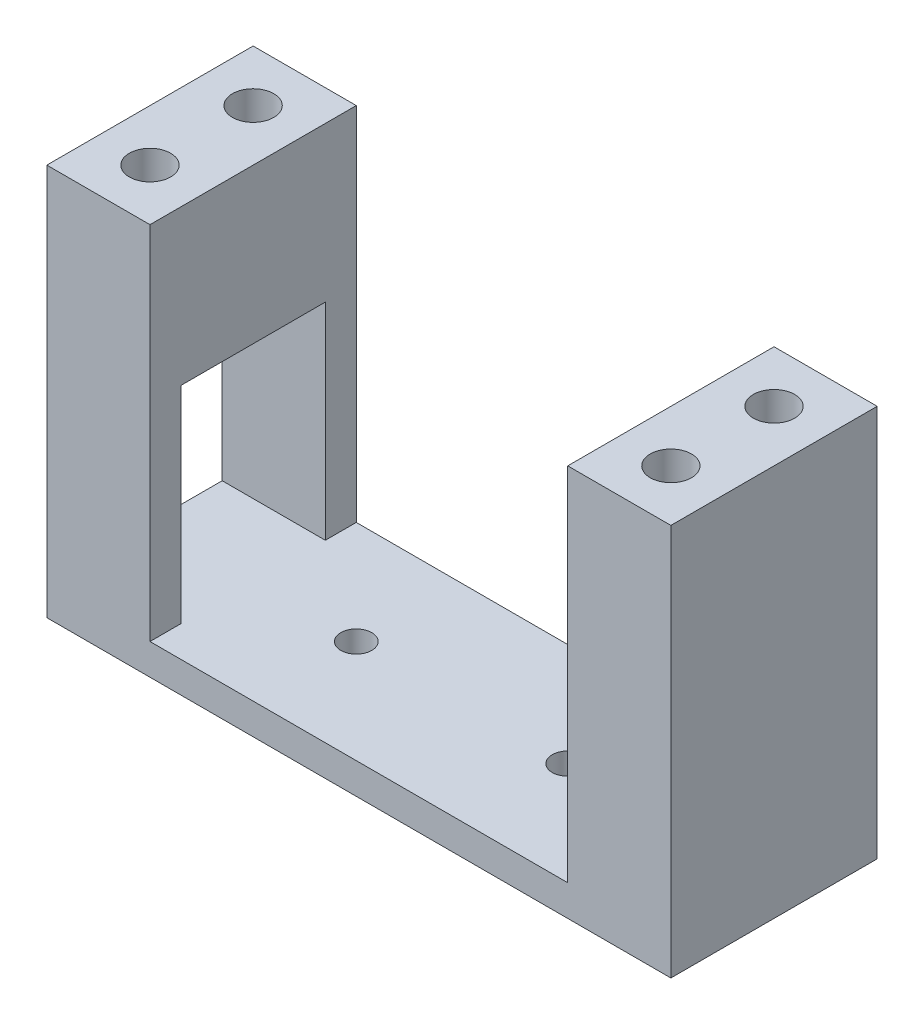
from build123d import *

# Parameters (mm, degrees)
EXTRUDE_2_DEPTH     = 20
CUT_EXTRUDE_1_REACH = 76.191
SKETCH_3_W          = 14
SKETCH_3_H          = 20
SKETCH_4_R          = 2
CUT_EXTRUDE_2_DEPTH = 10
SKETCH_5_R          = 1.5
CUT_EXTRUDE_3_DEPTH = 10


with BuildPart() as part:
    # Эскиз2 → Бобышка-Вытянуть2 (new body)
    with BuildSketch(Plane.XY):
        Polygon((0, 0), (60.5, 0), (60.5, 38), (50.5, 38), (50.5, 3), (10, 3), (10, 38), (0, 38), align=None)
    extrude(amount=EXTRUDE_2_DEPTH)

    # Эскиз3 → Вырез-Вытянуть1 (cut, up to next)
    with BuildSketch(Plane.ZY, mode=Mode.PRIVATE) as cut_extrude_1_sk1:
        with Locations((10, 13)):
            Rectangle(SKETCH_3_W, SKETCH_3_H)
    cut_extrude_1_tool1 = extrude(cut_extrude_1_sk1.sketch, amount=-CUT_EXTRUDE_1_REACH, mode=Mode.PRIVATE) & part.part
    add(cut_extrude_1_tool1.solids().sort_by_distance((0, 13, 10))[0], mode=Mode.SUBTRACT)

    # Эскиз4 → Вырез-Вытянуть2 (cut)
    with BuildSketch(Plane(origin=(0, 38, 0), x_dir=(1, 0, 0), z_dir=(0, 1, 0))):
        with Locations(Location((5, -5, 0), (0, 0, 270))):
            Circle(SKETCH_4_R)
        with Locations(Location((5, -15, 0), (0, 0, 270))):
            Circle(SKETCH_4_R)
        with Locations(Location((55.5, -5, 0), (0, 0, 270))):
            Circle(SKETCH_4_R)
        with Locations(Location((55.5, -15, 0), (0, 0, 270))):
            Circle(SKETCH_4_R)
    extrude(amount=-CUT_EXTRUDE_2_DEPTH, mode=Mode.SUBTRACT)

    # Эскиз5 → Вырез-Вытянуть3 (cut)
    with BuildSketch(Plane.XZ):
        with Locations(Location((20, 10, 0), (0, 0, 270))):
            Circle(SKETCH_5_R)
        with Locations(Location((40.5, 10, 0), (0, 0, 270))):
            Circle(SKETCH_5_R)
    extrude(amount=-CUT_EXTRUDE_3_DEPTH, mode=Mode.SUBTRACT)


solid = part.part
